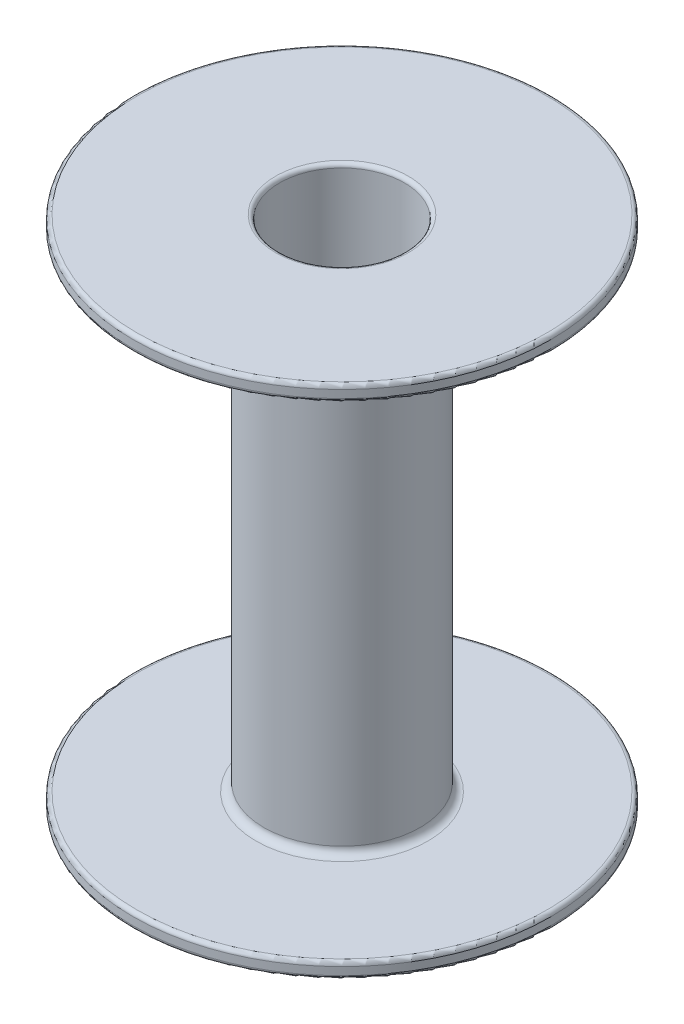
from build123d import *


with BuildPart() as part:
    # Croquis1 → Revolución1 (revolve)
    with BuildSketch(Plane.XY, mode=Mode.PRIVATE) as revoluci_n1_sk:
        with BuildLine():
            Line((8, 37.343958304), (8, -27.656041696))
            ThreePointArc((8, -27.656041696), (8.146446609, -28.009595087), (8.5, -28.156041696))
            Line((8.5, -28.156041696), (26.26, -28.156041696))
            ThreePointArc((26.26, -28.156041696), (26.613553391, -28.009595087), (26.76, -27.656041696))
            Line((26.76, -27.656041696), (26.76, -26.656041696))
            ThreePointArc((26.76, -26.656041696), (26.613553391, -26.302488306), (26.26, -26.156041696))
            Line((26.26, -26.156041696), (11, -26.156041696))
            ThreePointArc((11, -26.156041696), (10.292893219, -25.863148478), (10, -25.156041696))
            Line((10, -25.156041696), (10, 35.343958304))
            ThreePointArc((10, 35.343958304), (10.146446609, 35.697511694), (10.5, 35.843958304))
            Line((10.5, 35.843958304), (26.26, 35.843958304))
            ThreePointArc((26.26, 35.843958304), (26.613553391, 35.990404913), (26.76, 36.343958304))
            Line((26.76, 36.343958304), (26.76, 37.343958304))
            ThreePointArc((26.76, 37.343958304), (26.613553391, 37.697511694), (26.26, 37.843958304))
            Line((26.26, 37.843958304), (8.5, 37.843958304))
            ThreePointArc((8.5, 37.843958304), (8.146446609, 37.697511694), (8, 37.343958304))
        make_face()
    revolve(revoluci_n1_sk.sketch.rotate(Axis((0, 20.974210771, 0), (0, -1, 0)), 90), axis=Axis((0, 20.974210771, 0), (0, -1, 0)))


solid = part.part
